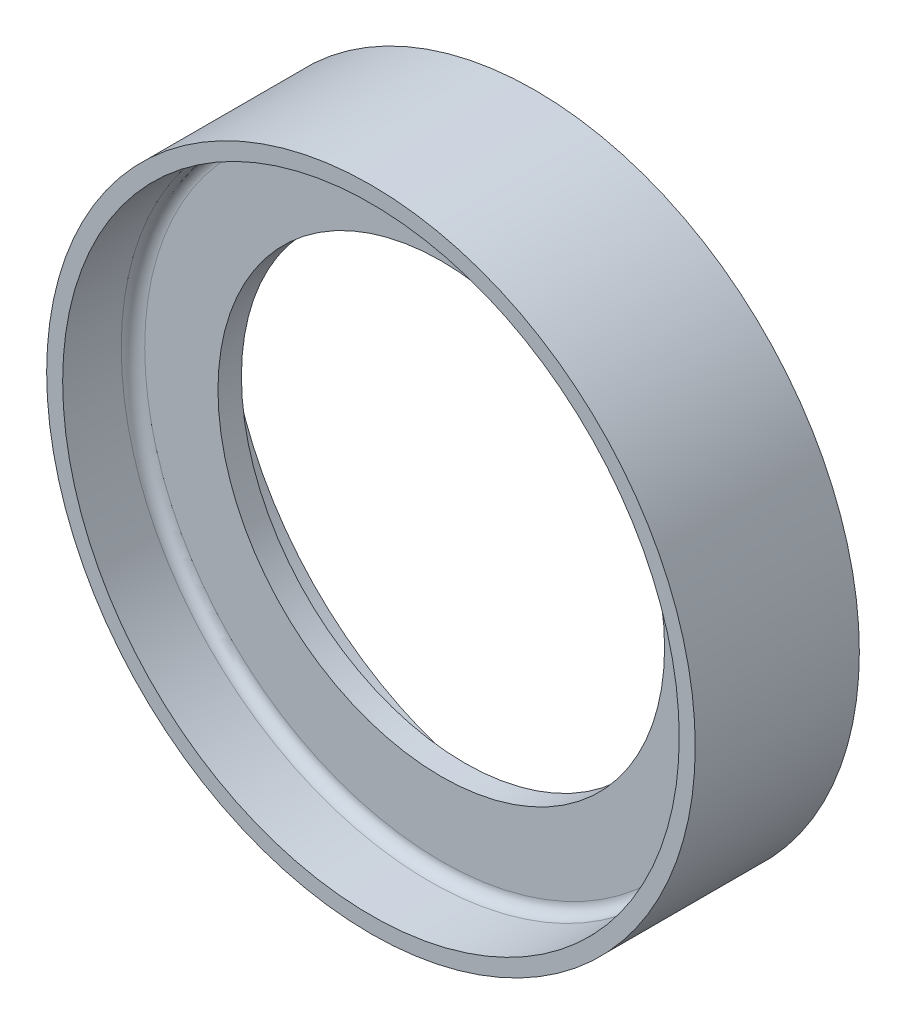
from build123d import *

# Parameters (mm, degrees)
SKETCH1_R           = 13.8327
SKETCH1_R_2         = 13.15
BOSS_EXTRUDE1_DEPTH = 3
BOSS_EXTRUDE2_START = 1
SKETCH2_R           = 13.8327
SKETCH2_R_2         = 9.525
BOSS_EXTRUDE2_DEPTH = 1
BOSS_EXTRUDE3_START = 3
SKETCH3_R           = 13.8327
SKETCH3_R_2         = 13.15
BOSS_EXTRUDE3_DEPTH = 3
FILLET1_R           = 0.5


with BuildPart() as part:
    # Sketch1 → Boss-Extrude1 (new body)
    with BuildSketch(Plane.XY):
        Circle(SKETCH1_R)
        Circle(SKETCH1_R_2, mode=Mode.SUBTRACT)
    extrude(amount=-BOSS_EXTRUDE1_DEPTH)

    # Sketch2 → Boss-Extrude2 (add)
    with BuildSketch(Plane.XY.offset(BOSS_EXTRUDE2_START)):
        Circle(SKETCH2_R)
        Circle(SKETCH2_R_2, mode=Mode.SUBTRACT)
    extrude(amount=-BOSS_EXTRUDE2_DEPTH)

    # Sketch3 → Boss-Extrude3 (add)
    with BuildSketch(Plane.XY.offset(1).offset(BOSS_EXTRUDE3_START)):
        Circle(SKETCH3_R)
        Circle(SKETCH3_R_2, mode=Mode.SUBTRACT)
    extrude(amount=-BOSS_EXTRUDE3_DEPTH)

    # Fillet1
    fillet1_edges = [part.edges().sort_by_distance(p)[0] for p in [
        (-13.15, 0, 0),
        (-13.15, 0, 1),
    ]]
    fillet(fillet1_edges, radius=FILLET1_R)


solid = part.part
